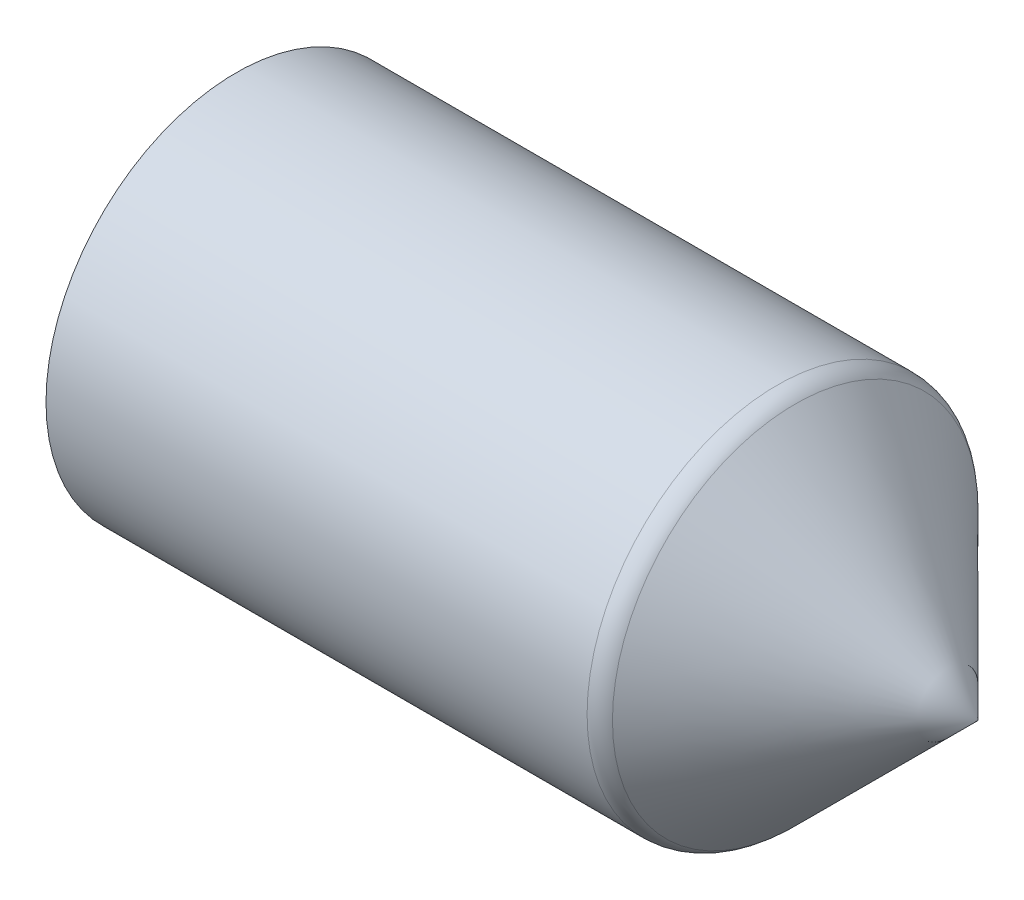
from build123d import *

# Parameters (mm, degrees)
CUT_EXTRUDE1_DEPTH = 2.1
CHAMFER1_SIZE      = 0.15
CHAMFER1_SIZE2     = 0.259807621
FILLET1_R          = 0.2


with BuildPart() as part:
    # Sketch1 → Revolve1 (revolve)
    with BuildSketch(Plane.XY, mode=Mode.PRIVATE) as revolve1_sk:
        Polygon((0, 1.5), (0, 0), (6, 0), (4.5, 1.5), align=None)
    revolve(revolve1_sk.sketch.rotate(Axis((0, 0, 0), (1, 0, 0)), 90), axis=Axis((0, 0, 0), (1, 0, 0)))

    # Sketch2 → Cut-Extrude1 (cut)
    with BuildSketch(Plane.ZY):
        Polygon((0, -0.866025404), (0.75, -0.433012702), (0.75, 0.433012702), (0, 0.866025404), (-0.75, 0.433012702), (-0.75, -0.433012702), align=None)
    extrude(amount=-CUT_EXTRUDE1_DEPTH, mode=Mode.SUBTRACT)

    # Chamfer1
    chamfer1_edges = [part.edges().sort_by_distance(p)[0] for p in [
        (0, 0, -1.5),
    ]]
    chamfer1_side = [part.faces().sort_by_distance(p)[0] for p in [
        (2.25, 0, -1.5),
    ]]
    chamfer(chamfer1_edges, length=CHAMFER1_SIZE, length2=CHAMFER1_SIZE2, reference=chamfer1_side[0])

    # Fillet1
    fillet1_edges = [part.edges().sort_by_distance(p)[0] for p in [
        (4.5, 0, -1.5),
    ]]
    fillet(fillet1_edges, radius=FILLET1_R)


solid = part.part
